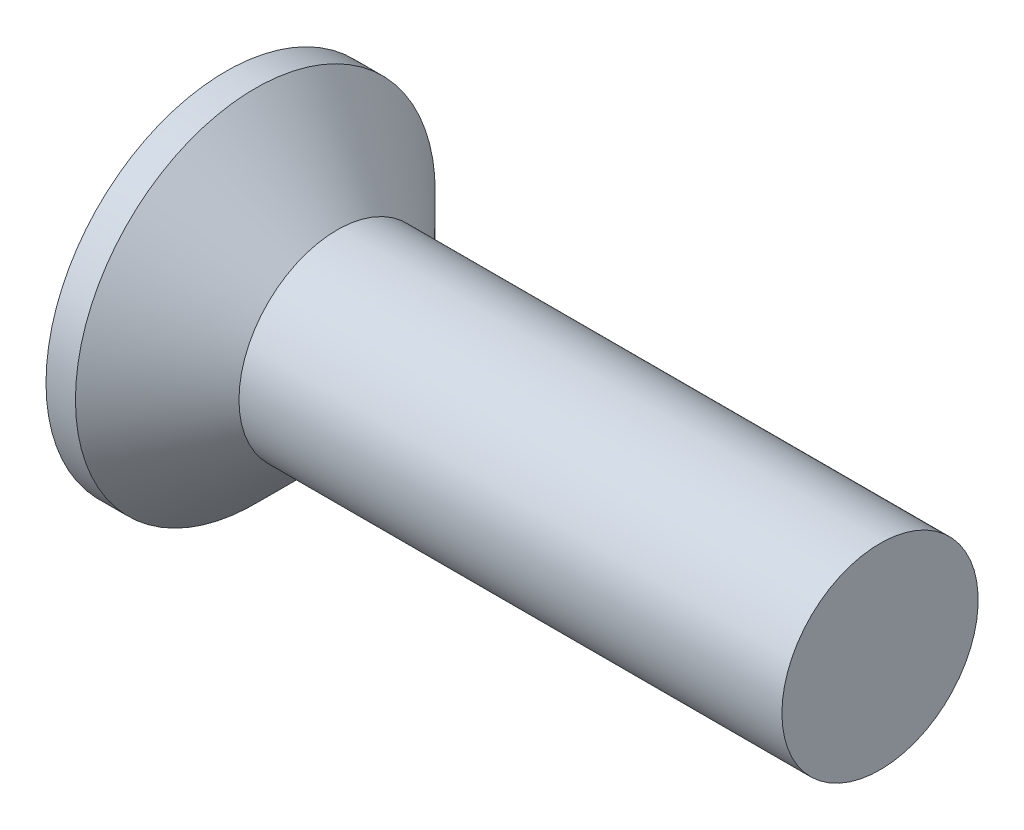
from build123d import *

# Parameters (mm, degrees)
CIRPATTERN1_COUNT = 2
CIRPATTERN1_ANGLE = 90


with BuildPart() as part:
    # BodySke → Base-Revolve (revolve)
    with BuildSketch(Plane.XY, mode=Mode.PRIVATE) as base_revolve_sk:
        Polygon((0, 0), (0, 2.75), (0.45, 2.75), (1.7, 1.5), (10, 1.5), (10, 0), align=None)
    revolve(base_revolve_sk.sketch.rotate(Axis((-6.35, 0, 0), (1, 0, 0)), 90), axis=Axis((-6.35, 0, 0), (1, 0, 0)))

    # Sketch3 → Cross section 0
    with BuildSketch(Plane.ZY):
        with BuildLine():
            Line((-0.395, 1.55), (0.395, 1.55))
            Line((0.395, 1.55), (0.395, -1.55))
            Line((0.395, -1.55), (-0.395, -1.55))
            Line((-0.395, -1.55), (-0.395, 1.55))
        make_face()
    # Sketch4 → Cross section 1
    with BuildSketch(Plane.ZY.offset(-2.08)):
        with BuildLine():
            Line((-0.1975, 0.1975), (0.1975, 0.1975))
            Line((0.1975, 0.1975), (0.1975, -0.1975))
            Line((0.1975, -0.1975), (-0.1975, -0.1975))
            Line((-0.1975, -0.1975), (-0.1975, 0.1975))
        make_face()
    cross = loft(mode=Mode.SUBTRACT)

    # CirPattern1: Cross ×2 about axis
    cirpattern1_axis = Axis((0, 0, 0), (1, 0, 0))
    for i in range(1, CIRPATTERN1_COUNT):
        add(cross.rotate(cirpattern1_axis, i * CIRPATTERN1_ANGLE / (CIRPATTERN1_COUNT - 1)), mode=Mode.SUBTRACT)


solid = part.part
